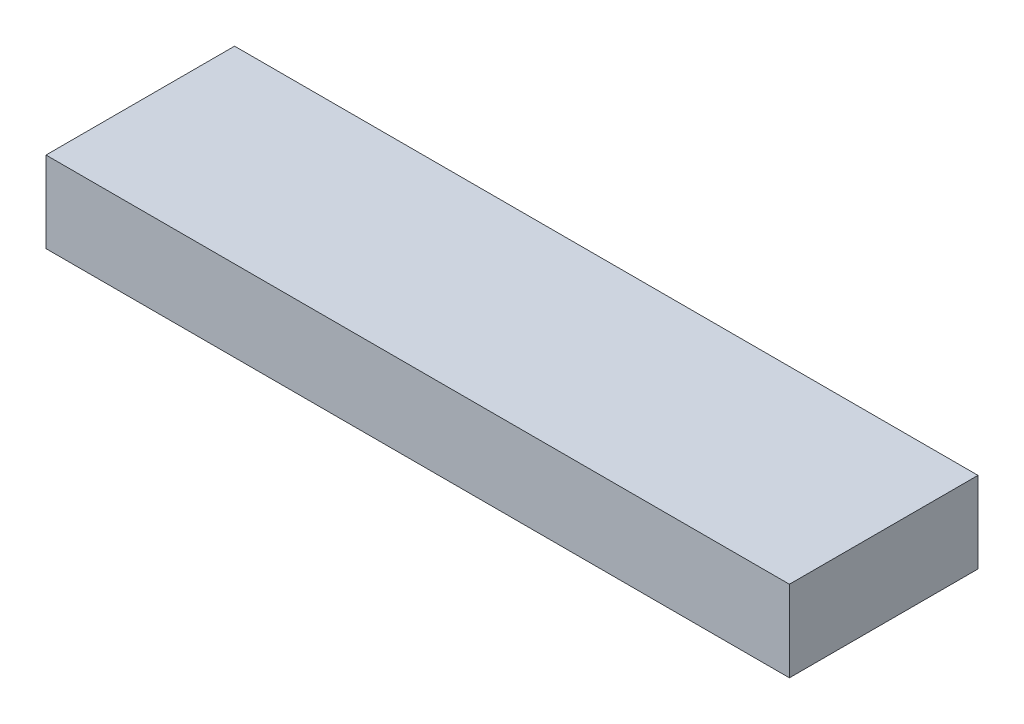
from build123d import *

# Parameters (mm, degrees)
SKETCH_1_W      = 39.42
SKETCH_1_H      = 4.3
EXTRUDE_1_DEPTH = 10


with BuildPart() as part:
    # 草图1 → 凸台-拉伸1 (new body)
    with BuildSketch(Plane.XY):
        with Locations((0, 2.15)):
            Rectangle(SKETCH_1_W, SKETCH_1_H)
    extrude(amount=EXTRUDE_1_DEPTH)


solid = part.part
